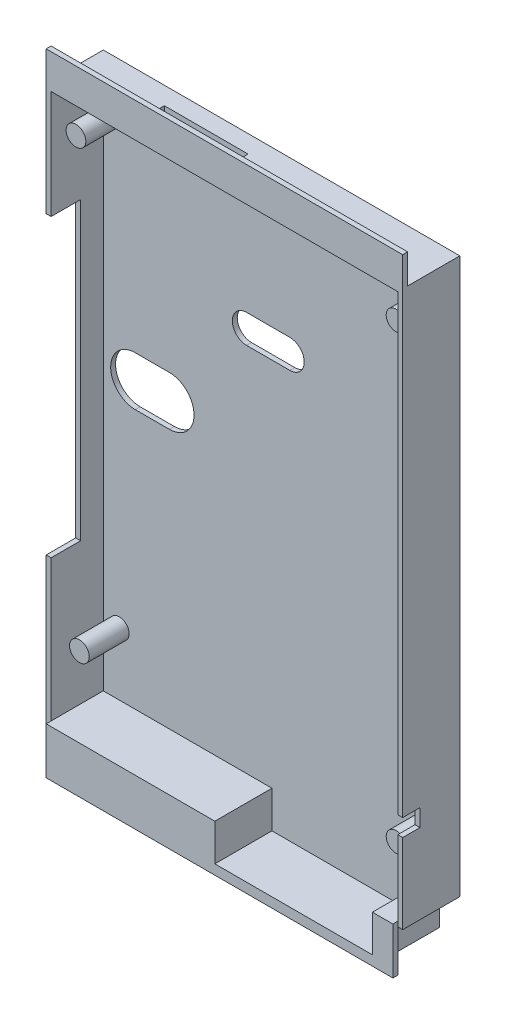
from build123d import *

# Parameters (mm, degrees)
ESBO_O1_W                     = 170.2
ESBO_O1_H                     = 111.2
RESSALTO_EXTRUS_O1_DEPTH      = 0.9
ESBO_O4_W                     = 176.2
ESBO_O4_H                     = 117.2
RESSALTO_EXTRUS_O3_DEPTH      = 1
ESBO_O5_W                     = 32
ESBO_O5_H                     = 1.9
CORTE_EXTRUS_O3_DEPTH         = 5
ESBO_O7_W                     = 70.4
ESBO_O7_H                     = 6
ESBO_O7_H_2                   = 1
RESSALTO_EXTRUS_O4_DEPTH      = 1
ESBO_O7_3_W                   = 70.4
ESBO_O7_3_H                   = 1
RESSALTO_EXTRUS_O5_DEPTH      = 11.6
RESSALTO_EXTRUS_O6_START      = 11.6
RESSALTO_EXTRUS_O6_DEPTH      = 1
RESSALTO_EXTRUS_O7_DEPTH      = 11.6
RESSALTO_EXTRUS_O7_DEPTH_BACK = 1
RESSALTO_EXTRUS_O8_START      = -1
RESSALTO_EXTRUS_O8_DEPTH      = 1
RESSALTO_EXTRUS_O9_DEPTH      = 1
RESSALTO_EXTRUS_O10_DEPTH     = 1
ESBO_O11_W                    = 6
ESBO_O11_H                    = 60
CORTE_EXTRUS_O4_DEPTH         = 1
ESBO_O12_W                    = 3.5
ESBO_O12_H                    = 3.5
CORTE_EXTRUS_O5_DEPTH         = 1
ESBO_O13_W                    = 17
ESBO_O13_H                    = 7
CORTE_EXTRUS_O6_DEPTH         = 1
CORTE_EXTRUS_O7_DEPTH         = 1
CORTE_EXTRUS_O8_DEPTH         = 1
CORTE_EXTRUS_O9_DEPTH         = 215.230343322
CORTE_EXTRUS_O9_DEPTH_BACK    = 215.230343322
ESBO_O17_W                    = 40.80761737
ESBO_O17_H                    = 153.828822039
ESBO_O18_R                    = 2
RESSALTO_EXTRUS_O11_DEPTH     = 8.1


with BuildPart() as part:
    # Esboço1 → Ressalto-extrusão1 (new body)
    with BuildSketch(Plane.XY):
        with Locations((91, 62.6)):
            Rectangle(ESBO_O1_W, ESBO_O1_H)
    extrude(amount=RESSALTO_EXTRUS_O1_DEPTH)

    # Esboço4 → Ressalto-extrusão3 (add)
    with BuildSketch(Plane(origin=(0, 0, 0), x_dir=(-1, 0, 0), z_dir=(0, 0, -1))):
        with Locations((-91, 62.6)):
            Rectangle(ESBO_O4_W, ESBO_O4_H)
    extrude(amount=RESSALTO_EXTRUS_O3_DEPTH)

    # Esboço5 → Corte-extrusão3 (cut)
    with BuildSketch(Plane.XZ.offset(-4)):
        with Locations((91, -0.05)):
            Rectangle(ESBO_O5_W, ESBO_O5_H)
    extrude(amount=-CORTE_EXTRUS_O3_DEPTH, mode=Mode.SUBTRACT)

    # Esboço7 → Ressalto-extrusão4 (add)
    with BuildSketch(Plane(origin=(0, 0, -1), x_dir=(-1, 0, 0), z_dir=(0, 0, -1))):
        with Locations((-75.95, 118.2)):
            Rectangle(ESBO_O7_W, ESBO_O7_H)
        with Locations((-75.95, 114.7)):
            Rectangle(ESBO_O7_W, ESBO_O7_H_2)
    extrude(amount=RESSALTO_EXTRUS_O4_DEPTH)

    # Esboço7<3> → Ressalto-extrusão5 (add)
    with BuildSketch(Plane(origin=(0, 0, -1), x_dir=(-1, 0, 0), z_dir=(0, 0, -1))):
        with Locations((-75.95, 114.7)):
            Rectangle(ESBO_O7_3_W, ESBO_O7_3_H)
    extrude(amount=RESSALTO_EXTRUS_O5_DEPTH)

    # Esboço7<4> → Ressalto-extrusão6 (add)
    with BuildSketch(Plane(origin=(0, 0, -1), x_dir=(-1, 0, 0), z_dir=(0, 0, -1)).offset(RESSALTO_EXTRUS_O6_START)):
        Polygon((-40.75, 114.2), (-111.15, 114.2), (-111.15, 4), (-107, 4), (-107, 9), (-75, 9), (-75, 4), (-40.75, 4), align=None)
        Polygon((-107, 4), (-111.15, 4), (-111.15, 3.5), (-107, 3.5), (-107, -4), (-75, -4), (-75, 3.5), (-40.75, 3.5), (-40.75, 4), (-75, 4), (-75, 9), (-107, 9), align=None)
        Polygon((-107, 3.5), (-111.15, 3.5), (-111.15, 2.5), (-108, 2.5), (-108, -5), (-74, -5), (-74, 2.5), (-40.75, 2.5), (-40.75, 3.5), (-75, 3.5), (-75, -4), (-107, -4), align=None)
    extrude(amount=-RESSALTO_EXTRUS_O6_DEPTH)

    # Esboço7<5> → Ressalto-extrusão7 (add, two sides: drawn at the far end of the back side and taken through both)
    with BuildSketch(Plane(origin=(0, 0, -1), x_dir=(-1, 0, 0), z_dir=(0, 0, -1)).offset(-RESSALTO_EXTRUS_O7_DEPTH_BACK)):
        Polygon((-107, 3.5), (-111.15, 3.5), (-111.15, 2.5), (-108, 2.5), (-108, -5), (-74, -5), (-74, 2.5), (-40.75, 2.5), (-40.75, 3.5), (-75, 3.5), (-75, -4), (-107, -4), align=None)
    extrude(amount=RESSALTO_EXTRUS_O7_DEPTH + RESSALTO_EXTRUS_O7_DEPTH_BACK)

    # Esboço7<6> → Ressalto-extrusão8 (add)
    with BuildSketch(Plane(origin=(0, 0, -1), x_dir=(-1, 0, 0), z_dir=(0, 0, -1)).offset(RESSALTO_EXTRUS_O8_START)):
        Polygon((-74, 2.5), (-40.75, 2.5), (-40.75, -6), (-111.15, -6), (-111.15, 2.5), (-108, 2.5), (-108, -5), (-74, -5), align=None)
    extrude(amount=RESSALTO_EXTRUS_O8_DEPTH)

    # Esboço8 → Ressalto-extrusão9 (add)
    with BuildSketch(Plane(origin=(111.15, 0, 0), x_dir=(0, 0, -1), z_dir=(1, 0, 0))):
        Polygon((1, 121.2), (2, 121.2), (2, 115.2), (12.6, 115.2), (12.6, 2.5), (1, 2.5), align=None)
    extrude(amount=RESSALTO_EXTRUS_O9_DEPTH)

    # Esboço9 → Ressalto-extrusão10 (add)
    with BuildSketch(Plane.ZY.offset(-40.75)):
        Polygon((-2, 121.2), (-1, 121.2), (-1, 2.5), (-12.6, 2.5), (-12.6, 115.2), (-2, 115.2), align=None)
    extrude(amount=RESSALTO_EXTRUS_O10_DEPTH)

    # Esboço11 → Corte-extrusão4 (cut)
    with BuildSketch(Plane.ZY.offset(-39.75)):
        with Locations((-4, 62.2)):
            Rectangle(ESBO_O11_W, ESBO_O11_H)
    extrude(amount=-CORTE_EXTRUS_O4_DEPTH, mode=Mode.SUBTRACT)

    # Esboço12 → Corte-extrusão5 (cut)
    with BuildSketch(Plane(origin=(112.15, 0, 0), x_dir=(0, 0, -1), z_dir=(1, 0, 0))):
        with Locations((2.75, 20.456846579)):
            Rectangle(ESBO_O12_W, ESBO_O12_H)
    extrude(amount=-CORTE_EXTRUS_O5_DEPTH, mode=Mode.SUBTRACT)

    # Esboço13 → Corte-extrusão6 (cut)
    with BuildSketch(Plane(origin=(0, 115.2, 0), x_dir=(1, 0, 0), z_dir=(0, 1, 0))):
        with Locations((64.25, 5.5)):
            Rectangle(ESBO_O13_W, ESBO_O13_H)
    extrude(amount=-CORTE_EXTRUS_O6_DEPTH, mode=Mode.SUBTRACT)

    # Esboço14 → Corte-extrusão7 (cut)
    with BuildSketch(Plane(origin=(0, 0, -12.6), x_dir=(-1, 0, 0), z_dir=(0, 0, -1))):
        with BuildLine():
            Line((-54.178505269, 66.2), (-47.245781338, 66.2))
            ThreePointArc((-47.245781338, 66.2), (-42.245781338, 61.2), (-47.245781338, 56.2))
            Line((-47.245781338, 56.2), (-54.178505269, 56.2))
            ThreePointArc((-54.178505269, 56.2), (-59.178505269, 61.2), (-54.178505269, 66.2))
        make_face()
    extrude(amount=-CORTE_EXTRUS_O7_DEPTH, mode=Mode.SUBTRACT)

    # Esboço15 → Corte-extrusão8 (cut)
    with BuildSketch(Plane(origin=(0, 0, -12.6), x_dir=(-1, 0, 0), z_dir=(0, 0, -1))):
        with BuildLine():
            Line((-78.65004231, 84.60004231), (-69.84995769, 84.60004231))
            ThreePointArc((-69.84995769, 84.60004231), (-66.949915379, 81.7), (-69.84995769, 78.79995769))
            Line((-69.84995769, 78.79995769), (-78.65004231, 78.79995769))
            ThreePointArc((-78.65004231, 78.79995769), (-81.550084621, 81.7), (-78.65004231, 84.60004231))
        make_face()
    extrude(amount=-CORTE_EXTRUS_O8_DEPTH, mode=Mode.SUBTRACT)

    # Esboço17 → Corte-extrusão9 (cut, two sides: drawn at the far end of the back side and taken through both)
    with BuildSketch(Plane(origin=(179.1, 0, 0), x_dir=(0, 0, -1), z_dir=(1, 0, 0)).offset(-CORTE_EXTRUS_O9_DEPTH_BACK)):
        with Locations((-19.403808685, 80.91441102)):
            Rectangle(ESBO_O17_W, ESBO_O17_H)
    extrude(amount=CORTE_EXTRUS_O9_DEPTH + CORTE_EXTRUS_O9_DEPTH_BACK, mode=Mode.SUBTRACT)

    # Esboço18 → Ressalto-extrusão11 (add)
    with BuildSketch(Plane.XY.offset(-11.6)):
        with Locations((43.3, 106.45)):
            Circle(ESBO_O18_R)
        with Locations((108.3, 106.45)):
            Circle(ESBO_O18_R)
        with Locations((108.3, 14.75)):
            Circle(ESBO_O18_R)
        with Locations((44, 16.15)):
            Circle(ESBO_O18_R)
    extrude(amount=RESSALTO_EXTRUS_O11_DEPTH)


solid = part.part
